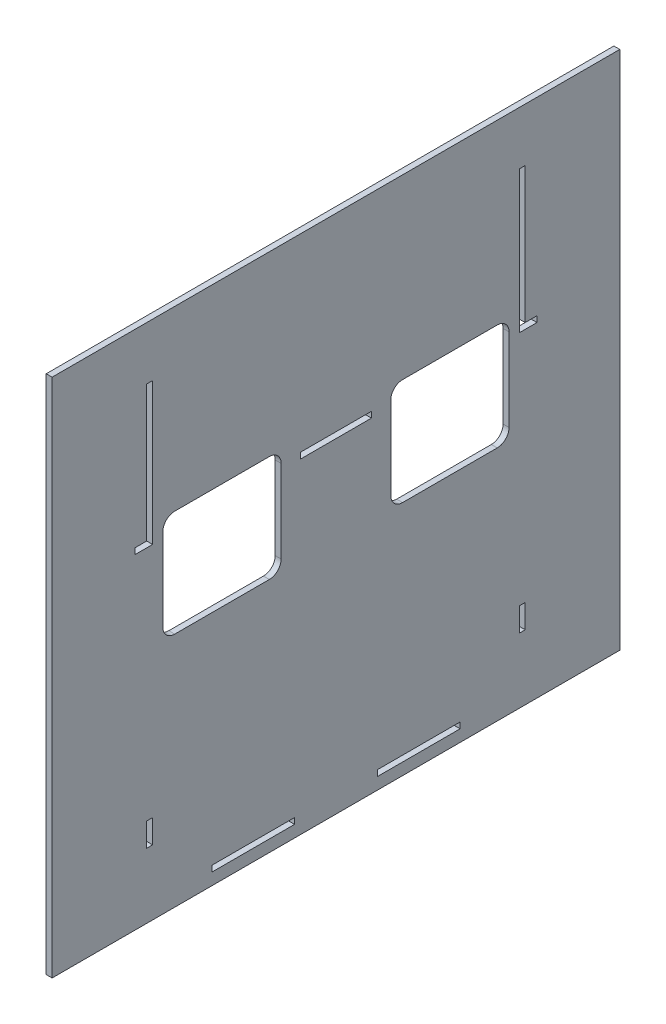
from build123d import *

# Parameters (mm, degrees)
SKETCH1_W            = 609.6
SKETCH1_H            = 558.8
MAIN_BODY_DEPTH      = 6.35
SKETCH2_W            = 6.35
SKETCH2_H            = 152.4
CUT_EXTRUDE1_DEPTH   = 414.530799941
SKETCH8_W            = 127
SKETCH8_H            = 114.3
CUT_EXTRUDE5_DEPTH   = 414.530799941
FILLET3_R            = 12.7
FILLET3_OF_MIRROR3_R = 12.7
SKETCH9_W            = 88.9
SKETCH9_H            = 6.35
CUT_EXTRUDE7_DEPTH   = 414.530799941
SKETCH10_W           = 6.35
SKETCH10_H           = 25.4
CUT_EXTRUDE8_DEPTH   = 414.530799941
SKETCH11_W           = 12.7
SKETCH11_H           = 6.35
CUT_EXTRUDE9_DEPTH   = 414.530799941
SKETCH12_W           = 76.2
SKETCH12_H           = 6.35
CUT_EXTRUDE10_DEPTH  = 414.530799941


with BuildPart() as part:
    # Sketch1 → Main Body (new body)
    with BuildSketch(Plane(origin=(0, 0, 0), x_dir=(0, 0, -1), z_dir=(1, 0, 0))):
        Rectangle(SKETCH1_W, SKETCH1_H)
    extrude(amount=MAIN_BODY_DEPTH)

    # Sketch2 → Cut-Extrude1 (cut, through all)
    with BuildSketch(Plane(origin=(6.35, 0, 0), x_dir=(0, 0, -1), z_dir=(1, 0, 0))):
        with Locations((-200.025, 146.05)):
            Rectangle(SKETCH2_W, SKETCH2_H)
        with Locations((200.025, 146.05)):
            Rectangle(SKETCH2_W, SKETCH2_H)
    extrude(amount=-CUT_EXTRUDE1_DEPTH, mode=Mode.SUBTRACT)

    # Sketch8 → Cut-Extrude5 (cut, through all)
    with BuildSketch(Plane(origin=(6.35, 0, 0), x_dir=(0, 0, -1), z_dir=(1, 0, 0))):
        with Locations((-122.359674, 31.75)):
            Rectangle(SKETCH8_W, SKETCH8_H)
    cut_extrude5 = extrude(amount=-CUT_EXTRUDE5_DEPTH, mode=Mode.SUBTRACT)

    # Fillet3
    fillet3_edges = [part.edges().sort_by_distance(p)[0] for p in [
        (3.175, 88.9, 58.859674),
        (3.175, -25.4, 58.859674),
        (3.175, -25.4, 185.859674),
        (3.175, 88.9, 185.859674),
    ]]
    fillet(fillet3_edges, radius=FILLET3_R)

    # Mirror3: Cut-Extrude5 across plane
    add(cut_extrude5.mirror(Plane.XY), mode=Mode.SUBTRACT)

    # Fillet3 of Mirror3
    fillet3_of_mirror3_edges = [part.edges().sort_by_distance(p)[0] for p in [
        (3.175, 88.9, -58.859674),
        (3.175, -25.4, -58.859674),
        (3.175, -25.4, -185.859674),
        (3.175, 88.9, -185.859674),
    ]]
    fillet(fillet3_of_mirror3_edges, radius=FILLET3_OF_MIRROR3_R)

    # Sketch9 → Cut-Extrude7 (cut, through all)
    with BuildSketch(Plane(origin=(6.35, 0, 0), x_dir=(0, 0, -1), z_dir=(1, 0, 0))):
        with Locations((-88.9, -263.525)):
            Rectangle(SKETCH9_W, SKETCH9_H)
    cut_extrude7 = extrude(amount=-CUT_EXTRUDE7_DEPTH, mode=Mode.SUBTRACT)

    # Mirror4: Cut-Extrude7 across plane
    add(cut_extrude7.mirror(Plane.XY), mode=Mode.SUBTRACT)

    # Sketch10 → Cut-Extrude8 (cut, through all)
    with BuildSketch(Plane(origin=(6.35, 0, 0), x_dir=(0, 0, -1), z_dir=(1, 0, 0))):
        with Locations((-200.025, -196.85)):
            Rectangle(SKETCH10_W, SKETCH10_H)
        with Locations((200.025, -196.85)):
            Rectangle(SKETCH10_W, SKETCH10_H)
    extrude(amount=-CUT_EXTRUDE8_DEPTH, mode=Mode.SUBTRACT)

    # Sketch11 → Cut-Extrude9 (cut, through all)
    with BuildSketch(Plane(origin=(6.35, 0, 0), x_dir=(0, 0, -1), z_dir=(1, 0, 0))):
        with Locations((-209.55, 73.025)):
            Rectangle(SKETCH11_W, SKETCH11_H)
        with Locations((209.55, 73.025)):
            Rectangle(SKETCH11_W, SKETCH11_H)
    extrude(amount=-CUT_EXTRUDE9_DEPTH, mode=Mode.SUBTRACT)

    # Sketch12 → Cut-Extrude10 (cut, through all)
    with BuildSketch(Plane(origin=(6.35, 0, 0), x_dir=(0, 0, -1), z_dir=(1, 0, 0))):
        with Locations((0, 73.025)):
            Rectangle(SKETCH12_W, SKETCH12_H)
    extrude(amount=-CUT_EXTRUDE10_DEPTH, mode=Mode.SUBTRACT)


solid = part.part
